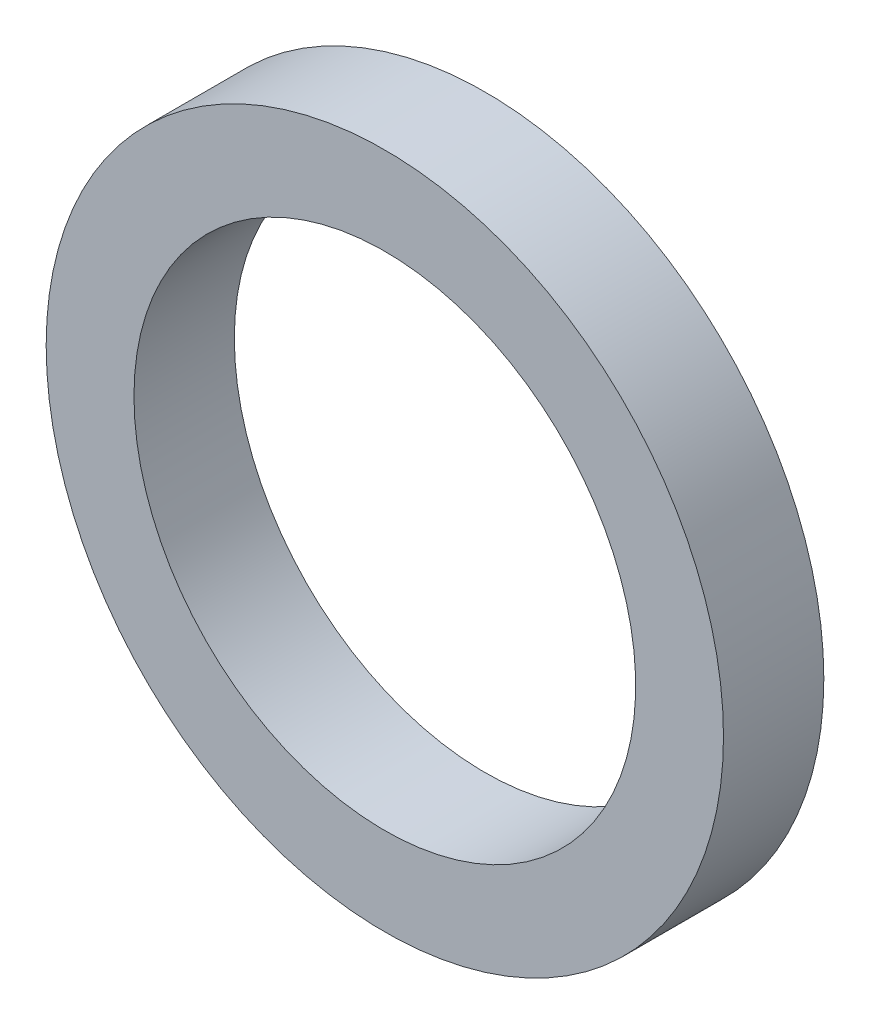
from build123d import *

# Parameters (mm, degrees)
SKETCH_1_R          = 13.5
EXTRUDE_1_DEPTH     = 4
SKETCH_2_R          = 10
CUT_EXTRUDE_1_DEPTH = 20.506409203


with BuildPart() as part:
    # ｽｹｯﾁ1 → ﾎﾞｽ - 押し出し1 (new body)
    with BuildSketch(Plane.XY):
        Circle(SKETCH_1_R)
    extrude(amount=EXTRUDE_1_DEPTH)

    # ｽｹｯﾁ2 → ｶｯﾄ - 押し出し1 (cut, through all)
    with BuildSketch(Plane(origin=(0, 0, 0), x_dir=(-1, 0, 0), z_dir=(0, 0, -1))):
        Circle(SKETCH_2_R)
    extrude(amount=-CUT_EXTRUDE_1_DEPTH, mode=Mode.SUBTRACT)


solid = part.part
